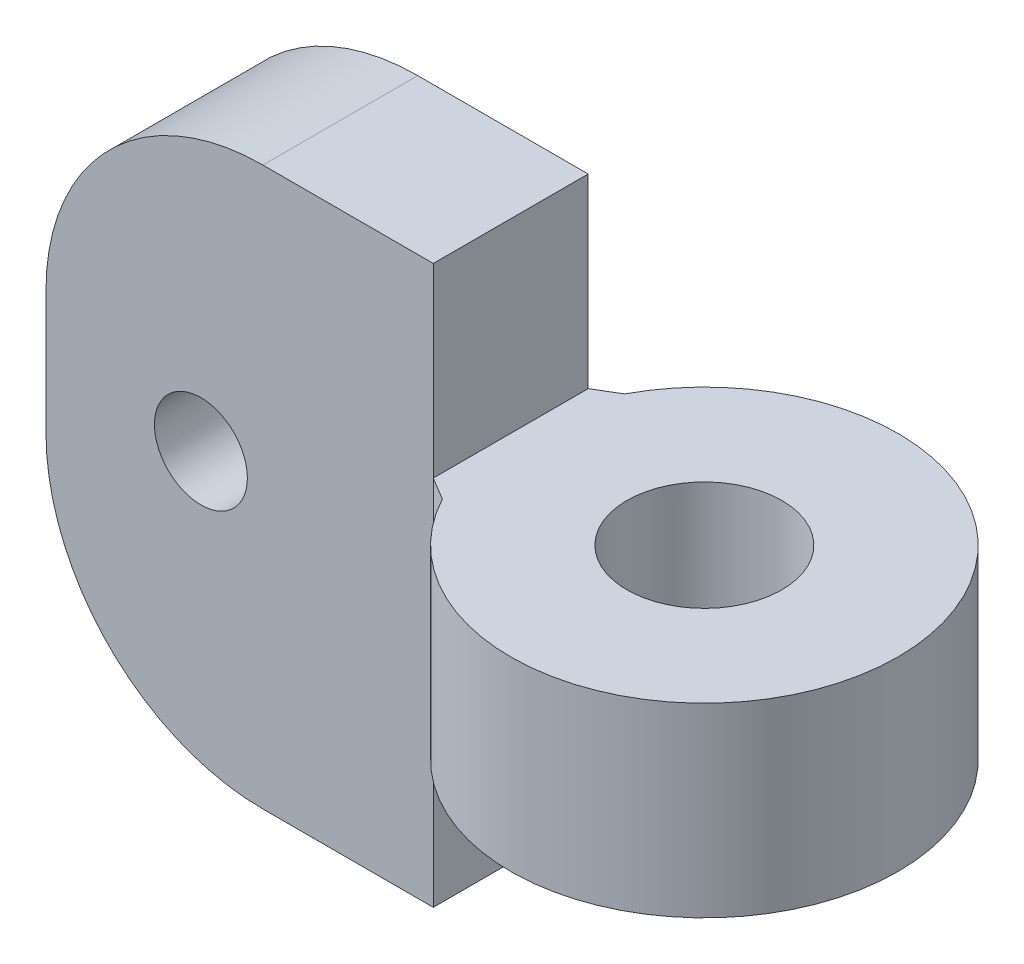
from build123d import *
from build123d.topology import SkipClean

# Parameters (mm, degrees)
CROQUIS1_R              = 1.5
SALIENTE_EXTRUIR1_DEPTH = 15
CROQUIS2_R              = 2.5
CORTAR_EXTRUIR1_DEPTH   = 20
CORTAR_EXTRUIR2_START   = -22
CORTAR_EXTRUIR2_DEPTH   = 22


with BuildPart() as part:
    # Croquis1 → Saliente-Extruir1 (new body)
    with BuildSketch(Plane.XY):
        with BuildLine():
            Line((11.25, 17.1), (11.25, 11.1))
            Line((11.25, 11.1), (23.75, 11.1))
            Line((23.75, 11.1), (23.75, 5.1))
            Line((23.75, 5.1), (11.25, 5.1))
            Line((11.25, 5.1), (11.25, -0.9))
            Line((11.25, -0.9), (5.75, -0.9))
            ThreePointArc((5.75, -0.9), (0.800252532, 1.150252532), (-1.25, 6.1))
            Line((-1.25, 6.1), (-1.25, 10.1))
            ThreePointArc((-1.25, 10.1), (0.800252532, 15.049747468), (5.75, 17.1))
            Line((5.75, 17.1), (11.25, 17.1))
        make_face()
        with Locations((3.75, 8.1)):
            Circle(CROQUIS1_R, mode=Mode.SUBTRACT)
    extrude(amount=SALIENTE_EXTRUIR1_DEPTH)

    # Croquis2 → Cortar-Extruir1 (cut)
    with BuildSketch(Plane(origin=(0, 0, 0), x_dir=(1, 0, 0), z_dir=(0, 1, 0))):
        with Locations(Location((17.5, -7.5, 0), (0, 0, 90))):
            Circle(CROQUIS2_R)
        with BuildLine():
            Line((17.5, -1.25), (11.25, 0))
            Line((11.25, 0), (11.126279301, 1.868603497))
            Line((11.126279301, 1.868603497), (29.663453957, 1.868603497))
            Line((29.663453957, 1.868603497), (29.663453957, -17.961269996))
            Line((29.663453957, -17.961269996), (11.25, -17.961269996))
            Line((11.25, -17.961269996), (11.25, -15))
            Line((11.25, -15), (17.5, -13.75))
            ThreePointArc((17.5, -13.75), (23.75, -7.5), (17.5, -1.25))
        make_face()
    extrude(amount=CORTAR_EXTRUIR1_DEPTH, mode=Mode.SUBTRACT)

    # Croquis3 → Cortar-Extruir2 (cut)
    with SkipClean():  # the faces are left unmerged after this step: merging them gives an invalid solid
        with BuildSketch(Plane(origin=(0, 17.1, 0), x_dir=(1, 0, 0), z_dir=(0, 1, 0)).offset(CORTAR_EXTRUIR2_START)):
            with BuildLine():
                Line((-4.130088798, -10), (11.25, -10))
                Line((11.25, -10), (11.985294118, -10.441176471))
                ThreePointArc((11.985294118, -10.441176471), (14.284401529, -12.859330786), (17.5, -13.75))
                Line((17.5, -13.75), (17.5, -15.581395259))
                Line((17.5, -15.581395259), (-4.130088798, -15.581395259))
                Line((-4.130088798, -15.581395259), (-4.130088798, -10))
            make_face()
            with BuildLine():
                Line((-3.464792336, -5), (11.25, -5))
                Line((11.25, -5), (11.985294118, -4.558823529))
                ThreePointArc((11.985294118, -4.558823529), (14.284401529, -2.140669214), (17.5, -1.25))
                Line((17.5, -1.25), (17.5, 1.677177667))
                Line((17.5, 1.677177667), (-3.464792336, 1.677177667))
                Line((-3.464792336, 1.677177667), (-3.464792336, -5))
            make_face()
        extrude(amount=CORTAR_EXTRUIR2_DEPTH, mode=Mode.SUBTRACT)


solid = part.part
